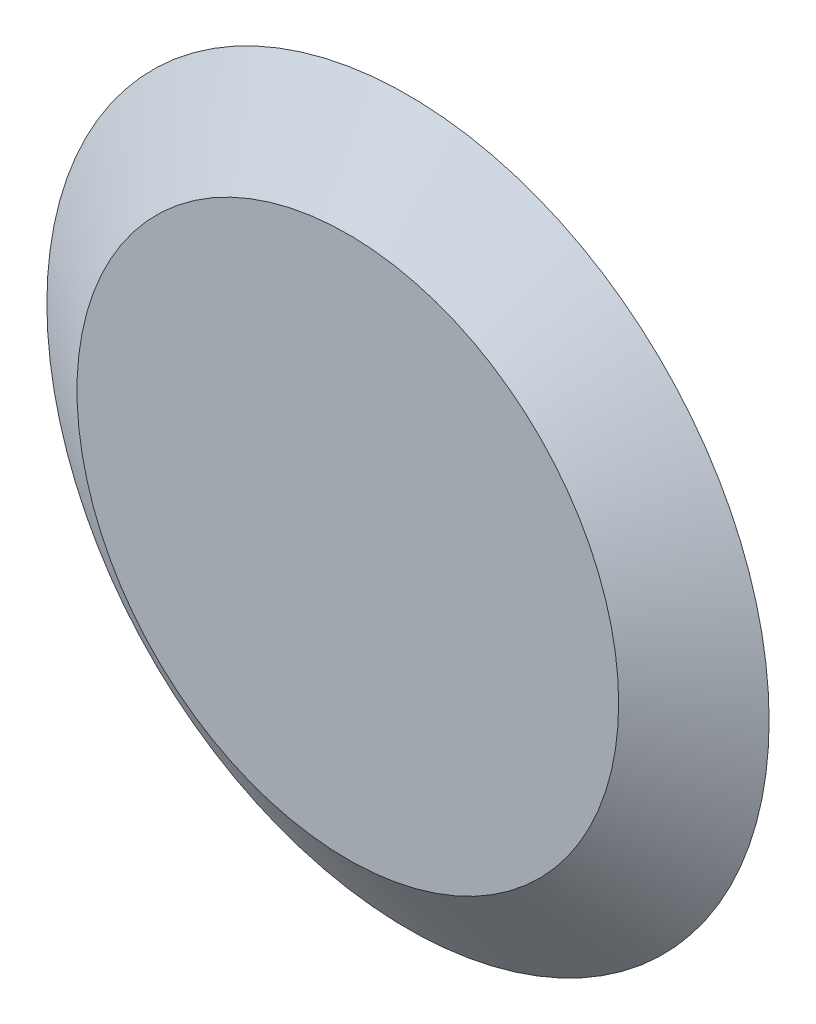
from build123d import *

# Parameters (mm, degrees)
ESBO_O3_R = 24
ESBO_O2_R = 18


with BuildPart() as part:
    # Esboço3 → Loft2 section 0
    with BuildSketch(Plane.XY.offset(4)):
        Circle(ESBO_O3_R)
    # Esboço2 → Loft2 section 1
    with BuildSketch(Plane.XY):
        Circle(ESBO_O2_R)
    loft2 = loft()

    # Espelhar1: Loft2 across plane
    add(loft2.mirror(Plane.XY.offset(4)))


solid = part.part
